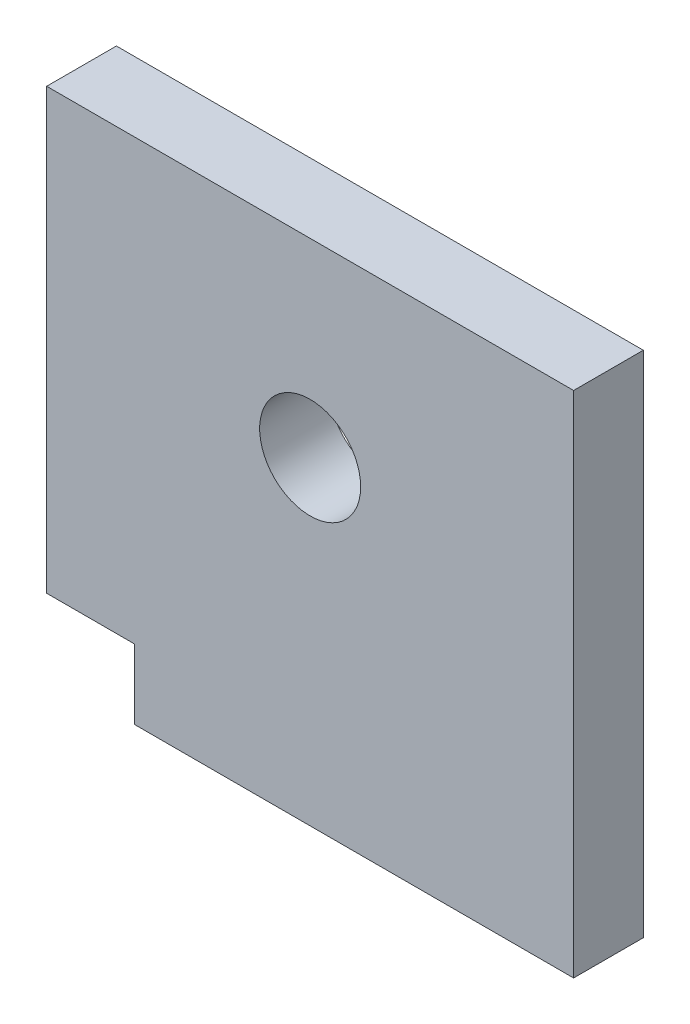
from build123d import *

# Parameters (mm, degrees)
SKETCH1_R           = 2.3
BOSS_EXTRUDE1_DEPTH = 3.175


with BuildPart() as part:
    # Sketch1 → Boss-Extrude1 (new body)
    with BuildSketch(Plane.XY):
        Polygon((0, 0), (0, 20), (24, 20), (24, 0), (24, -3.175), (4, -3.175), (4, 0), align=None)
        with Locations((12, 11.35)):
            Circle(SKETCH1_R, mode=Mode.SUBTRACT)
    extrude(amount=BOSS_EXTRUDE1_DEPTH)


solid = part.part
